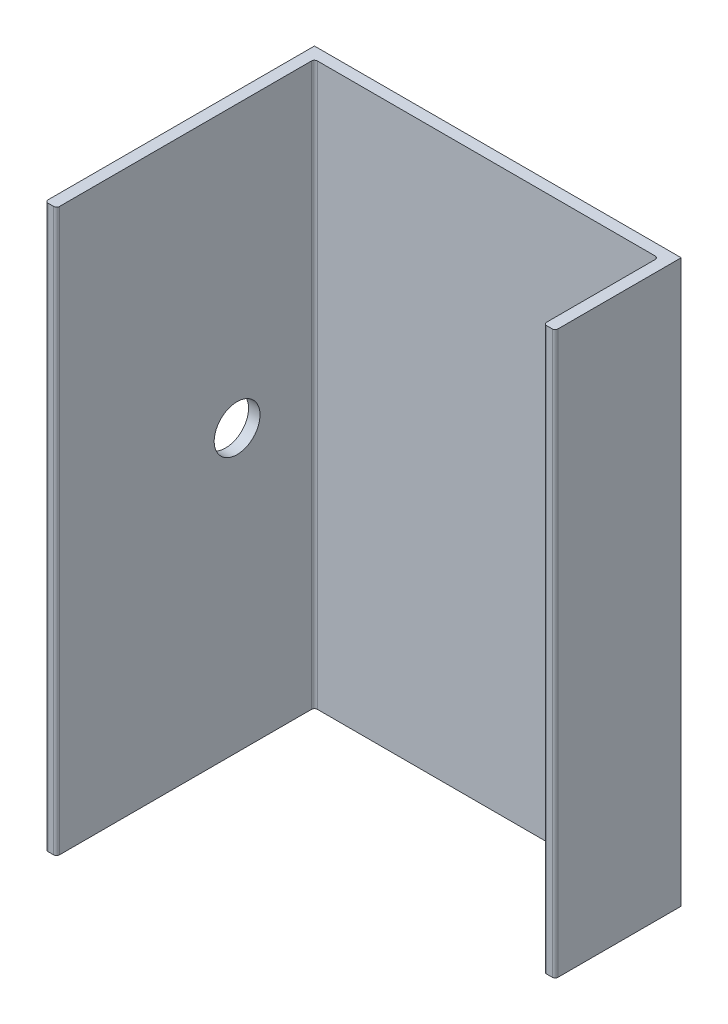
from build123d import *

# Parameters (mm, degrees)
SCHIZZO1_W                   = 64
SCHIZZO1_H                   = 98
ESTRUSIONE_ESTRUSIONE1_DEPTH = 2
SCHIZZO4_W                   = 2
SCHIZZO4_H                   = 98
ESTRUSIONE_ESTRUSIONE2_DEPTH = 45
SCHIZZO5_W                   = 2
SCHIZZO5_H                   = 98
ESTRUSIONE_ESTRUSIONE3_DEPTH = 20
RACCORDO1_R                  = 0.5
SCHIZZO6_R                   = 4
TAGLIO_ESTRUSIONE1_DEPTH     = 10


with BuildPart() as part:
    # Schizzo1 → Estrusione-Estrusione1 (new body)
    with BuildSketch(Plane.XY):
        Rectangle(SCHIZZO1_W, SCHIZZO1_H)
    extrude(amount=-ESTRUSIONE_ESTRUSIONE1_DEPTH)

    # Schizzo4 → Estrusione-Estrusione2 (add)
    with BuildSketch(Plane.XY):
        with Locations((-31, 0)):
            Rectangle(SCHIZZO4_W, SCHIZZO4_H)
    extrude(amount=ESTRUSIONE_ESTRUSIONE2_DEPTH)

    # Schizzo5 → Estrusione-Estrusione3 (add)
    with BuildSketch(Plane.XY):
        with Locations((31, 0)):
            Rectangle(SCHIZZO5_W, SCHIZZO5_H)
    extrude(amount=ESTRUSIONE_ESTRUSIONE3_DEPTH)

    # Raccordo1
    raccordo1_edges = [part.edges().sort_by_distance(p)[0] for p in [
        (-30, 0, 0),
        (-32, 0, 45),
        (-30, 0, 45),
        (30, 0, 0),
        (32, 0, 20),
        (30, 0, 20),
    ]]
    fillet(raccordo1_edges, radius=RACCORDO1_R)

    # Schizzo6 → Taglio-Estrusione1 (cut)
    with BuildSketch(Plane.ZY.offset(32)):
        with Locations(Location((13.5, 0, 0), (0, 0, 270))):
            Circle(SCHIZZO6_R)
    extrude(amount=-TAGLIO_ESTRUSIONE1_DEPTH, mode=Mode.SUBTRACT)


solid = part.part
